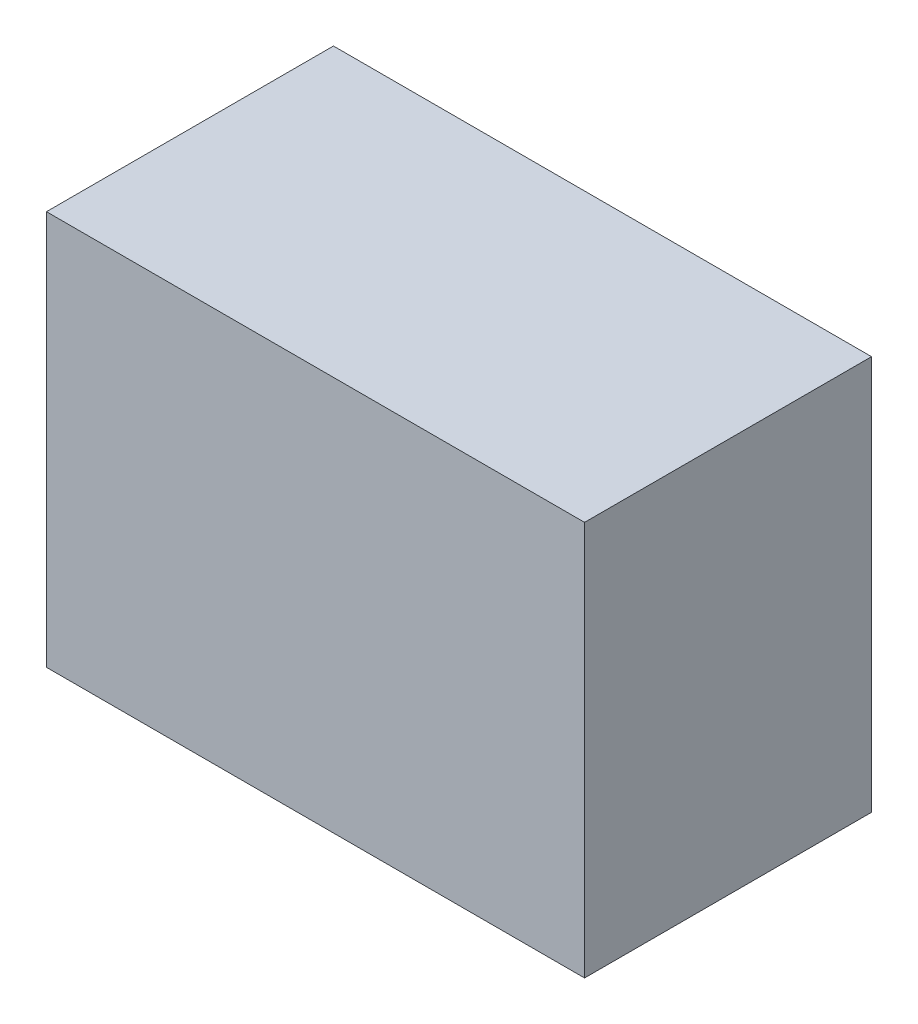
from build123d import *

# Parameters (mm, degrees)
SK_PUMP_BODY_W  = 45
SK_PUMP_BODY_H  = 24
PUMP_BODY_DEPTH = 33
INLET_START     = -2
SK_INLET_R      = 4
INLET_DEPTH     = 2


with BuildPart() as part:
    # SK Pump body → Pump body (new body)
    with BuildSketch(Plane(origin=(0, 0, 0), x_dir=(1, 0, 0), z_dir=(0, 1, 0))):
        with Locations((22.5, 12)):
            Rectangle(SK_PUMP_BODY_W, SK_PUMP_BODY_H)
    extrude(amount=PUMP_BODY_DEPTH)


with BuildPart() as body_2:
    # SK Inlet → Inlet (new body)
    with BuildSketch(Plane(origin=(0, 0, 0), x_dir=(0, 0, -1), z_dir=(1, 0, 0)).offset(INLET_START)):
        with Locations((12, 9)):
            Circle(SK_INLET_R)
    extrude(amount=INLET_DEPTH)


solid = Compound([part.part, body_2.part])
